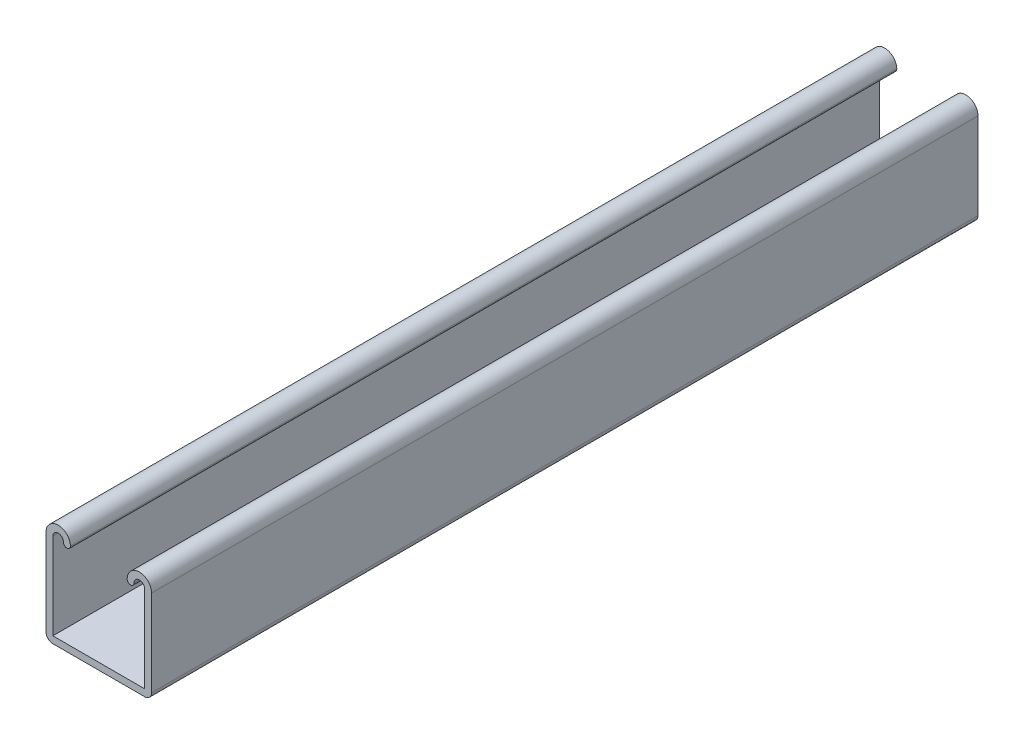
from build123d import *

# Parameters (mm, degrees)
EXTRUDE_1_DEPTH     = 323.85
SKETCH_2_R          = 7.112
CUT_EXTRUDE_1_DEPTH = 329.755380278


with BuildPart() as part:
    # 草图1 → 凸台-拉伸1 (new body)
    with BuildSketch(Plane.XY):
        with BuildLine():
            Line((0, 0), (35.98, 0))
            ThreePointArc((35.98, 0), (37.883814298, 0.788585702), (38.6724, 2.6924))
            Line((38.6724, 2.6924), (38.6724, 36.5252))
            ThreePointArc((38.6724, 36.5252), (33.8972, 41.3004), (29.122, 36.5252))
            ThreePointArc((29.122, 36.5252), (30.4682, 35.179), (31.8144, 36.5252))
            ThreePointArc((31.8144, 36.5252), (33.8972, 38.608), (35.98, 36.5252))
            Line((35.98, 36.5252), (35.98, 2.6924))
            Line((35.98, 2.6924), (0, 2.6924))
            Line((0, 2.6924), (0, 36.5252))
            ThreePointArc((0, 36.5252), (2.0828, 38.608), (4.1656, 36.5252))
            ThreePointArc((4.1656, 36.5252), (5.5118, 35.179), (6.858, 36.5252))
            ThreePointArc((6.858, 36.5252), (2.0828, 41.3004), (-2.6924, 36.5252))
            Line((-2.6924, 36.5252), (-2.6924, 2.6924))
            ThreePointArc((-2.6924, 2.6924), (-1.903814298, 0.788585702), (0, 0))
        make_face()
    extrude(amount=EXTRUDE_1_DEPTH)

    # 草图2 → 切除-拉伸1 (cut, through all)
    with BuildSketch(Plane(origin=(0, 0, 0), x_dir=(-1, 0, 0), z_dir=(0, -1, 0))):
        with Locations(Location((-17.99, -28.448, 0), (0, 0, 90))):
            Circle(SKETCH_2_R)
        with Locations(Location((-17.99, -76.2, 0), (0, 0, 90))):
            Circle(SKETCH_2_R)
        with Locations(Location((-17.99, -295.402, 0), (0, 0, 90))):
            Circle(SKETCH_2_R)
        with Locations(Location((-17.99, -247.65, 0), (0, 0, 90))):
            Circle(SKETCH_2_R)
    extrude(amount=-CUT_EXTRUDE_1_DEPTH, mode=Mode.SUBTRACT)


solid = part.part
